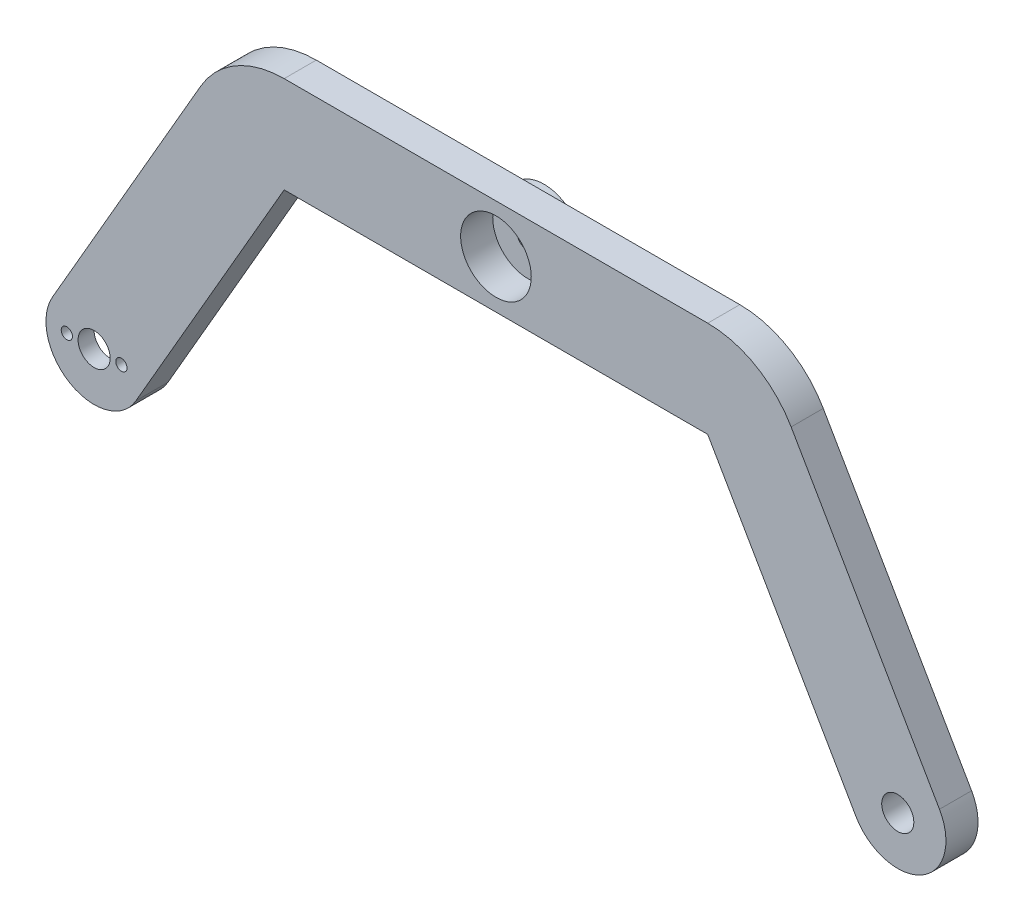
from build123d import *

# Parameters (mm, degrees)
SKETCH1_R           = 1.75
BOSS_EXTRUDE1_DEPTH = 10
SKETCH2_R           = 11
SKETCH2_R_2         = 5
CUT_EXTRUDE1_DEPTH  = 10
SKETCH3_R           = 12
BOSS_EXTRUDE2_DEPTH = 5
SKETCH4_R           = 13
CUT_EXTRUDE2_DEPTH  = 5
SKETCH5_R           = 3.5
CUT_EXTRUDE3_DEPTH  = 175.285919969


with BuildPart() as part:
    # Sketch1 → Boss-Extrude1 (new body)
    with BuildSketch(Plane.XY):
        with BuildLine():
            Line((65.95591629, 15), (-65.95591629, 15))
            ThreePointArc((-65.95591629, 15), (-80.95591629, 10.980762114), (-91.936678404, 0))
            Line((-91.936678404, 0), (-138.135251983, -80.018276676))
            ThreePointArc((-138.135251983, -80.018276676), (-132.644870926, -100.508657733), (-112.154489869, -95.018276676))
            Line((-112.154489869, -95.018276676), (-65.95591629, -15))
            Line((-65.95591629, -15), (65.95591629, -15))
            Line((65.95591629, -15), (112.154489869, -95.018276676))
            ThreePointArc((112.154489869, -95.018276676), (132.644870926, -100.508657733), (138.135251983, -80.018276676))
            Line((138.135251983, -80.018276676), (91.936678404, 0))
            ThreePointArc((91.936678404, 0), (80.95591629, 10.980762114), (65.95591629, 15))
        make_face()
        with Locations((-133.644870926, -87.518276676)):
            Circle(SKETCH1_R, mode=Mode.SUBTRACT)
        with Locations((-116.644870926, -87.518276676)):
            Circle(SKETCH1_R, mode=Mode.SUBTRACT)
    extrude(amount=BOSS_EXTRUDE1_DEPTH)

    # Sketch2 → Cut-Extrude1 (cut)
    with BuildSketch(Plane.XY.offset(10)):
        Circle(SKETCH2_R)
        with Locations((-125.144870926, -87.518276676)):
            Circle(SKETCH2_R_2)
        with Locations((125.144870926, -87.518276676)):
            Circle(SKETCH2_R_2)
    extrude(amount=-CUT_EXTRUDE1_DEPTH, mode=Mode.SUBTRACT)

    # Sketch3 → Boss-Extrude2 (add)
    with BuildSketch(Plane(origin=(0, 0, 0), x_dir=(-1, 0, 0), z_dir=(0, 0, -1))):
        Circle(SKETCH3_R)
    extrude(amount=BOSS_EXTRUDE2_DEPTH)

    # Sketch4 → Cut-Extrude2 (cut)
    with BuildSketch(Plane(origin=(0, 0, 0), x_dir=(-1, 0, 0), z_dir=(0, 0, -1))):
        with Locations((125.144870926, -87.518276676)):
            Circle(SKETCH4_R)
    extrude(amount=-CUT_EXTRUDE2_DEPTH, mode=Mode.SUBTRACT)

    # Sketch5 → Cut-Extrude3 (cut, through all)
    with BuildSketch(Plane.XY.offset(10)):
        Circle(SKETCH5_R)
    extrude(amount=-CUT_EXTRUDE3_DEPTH, mode=Mode.SUBTRACT)


solid = part.part
